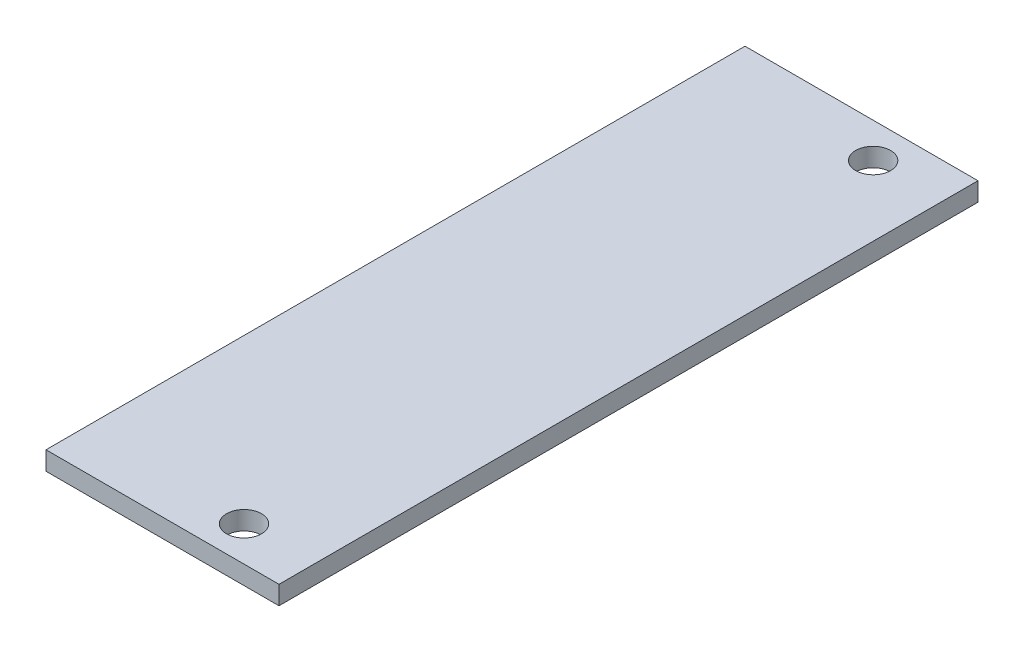
from build123d import *

# Parameters (mm, degrees)
SKETCH1_W       = 20
SKETCH1_H       = 60
SKETCH1_R       = 1.5
PCB_BOARD_DEPTH = 1.6


with BuildPart() as part:
    # Sketch1 → pcb_board (new body)
    with BuildSketch(Plane(origin=(0, 0, 0), x_dir=(1, 0, 0), z_dir=(0, 1, 0))):
        with Locations((10, 30)):
            Rectangle(SKETCH1_W, SKETCH1_H)
        with Locations(Location((14, 3, 0), (0, 0, 270))):
            Circle(SKETCH1_R, mode=Mode.SUBTRACT)
        with Locations(Location((14, 57, 0), (0, 0, 270))):
            Circle(SKETCH1_R, mode=Mode.SUBTRACT)
    extrude(amount=PCB_BOARD_DEPTH)


solid = part.part
